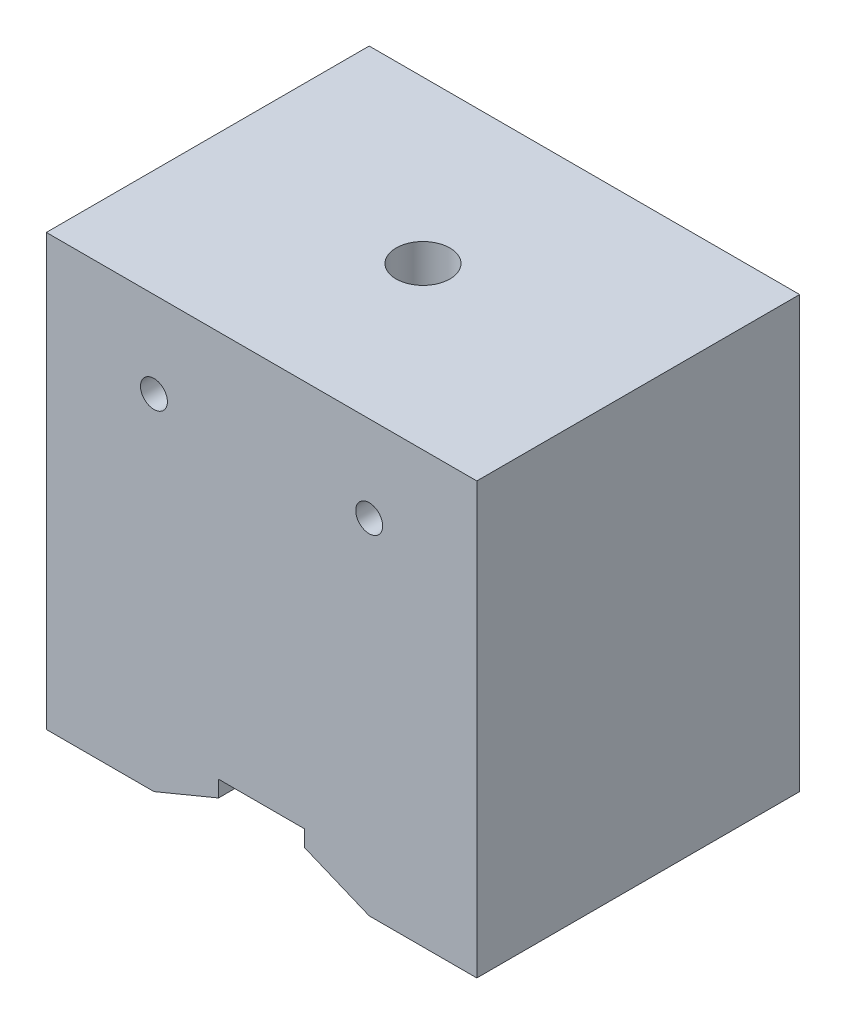
from build123d import *

# Parameters (mm, degrees)
SKETCH_1_W             = 40
SKETCH_1_H             = 40
EXTRUDE_1_DEPTH        = 30
CUT_EXTRUDE_1_DEPTH    = 65.031242374
HOLE_WIZARD_M6_1_D     = 5
HOLE_WIZARD_M6_1_DEPTH = 15
HOLE_WIZARD_M6_1_TIP   = 1.502151548
HOLE_WIZARD_M3_1_D     = 2.5
HOLE_WIZARD_M3_1_DEPTH = 7.5
HOLE_WIZARD_M3_1_TIP   = 0.751075774


with BuildPart() as part:
    # 草图1 → 凸台-拉伸1 (new body)
    with BuildSketch(Plane.XY):
        with Locations((20, 20)):
            Rectangle(SKETCH_1_W, SKETCH_1_H)
    extrude(amount=EXTRUDE_1_DEPTH)

    # 草图2 → 切除-拉伸1 (cut, through all)
    with BuildSketch(Plane.XY.offset(30)):
        Polygon((10, 0), (16, 2.485281374), (16, 4), (24, 4), (24, 2.485281374), (30, 0), align=None)
    extrude(amount=-CUT_EXTRUDE_1_DEPTH, mode=Mode.SUBTRACT)

    # M6 螺纹孔1
    with Locations(Plane(origin=(0, 40, 0), x_dir=(1, 0, 0), z_dir=(0, 1, 0))):
        with Locations((20, -15)):
            Hole(HOLE_WIZARD_M6_1_D / 2, depth=HOLE_WIZARD_M6_1_DEPTH)
            with Locations((0, 0, -(HOLE_WIZARD_M6_1_DEPTH + HOLE_WIZARD_M6_1_TIP / 2))):  # 118° drill point
                Cone(0, HOLE_WIZARD_M6_1_D / 2, HOLE_WIZARD_M6_1_TIP, mode=Mode.SUBTRACT)

    # M3 螺纹孔1
    with Locations(Plane.XY.offset(30)):
        with Locations((10, 32), (30, 32)):
            Hole(HOLE_WIZARD_M3_1_D / 2, depth=HOLE_WIZARD_M3_1_DEPTH)
            with Locations((0, 0, -(HOLE_WIZARD_M3_1_DEPTH + HOLE_WIZARD_M3_1_TIP / 2))):  # 118° drill point
                Cone(0, HOLE_WIZARD_M3_1_D / 2, HOLE_WIZARD_M3_1_TIP, mode=Mode.SUBTRACT)


solid = part.part
